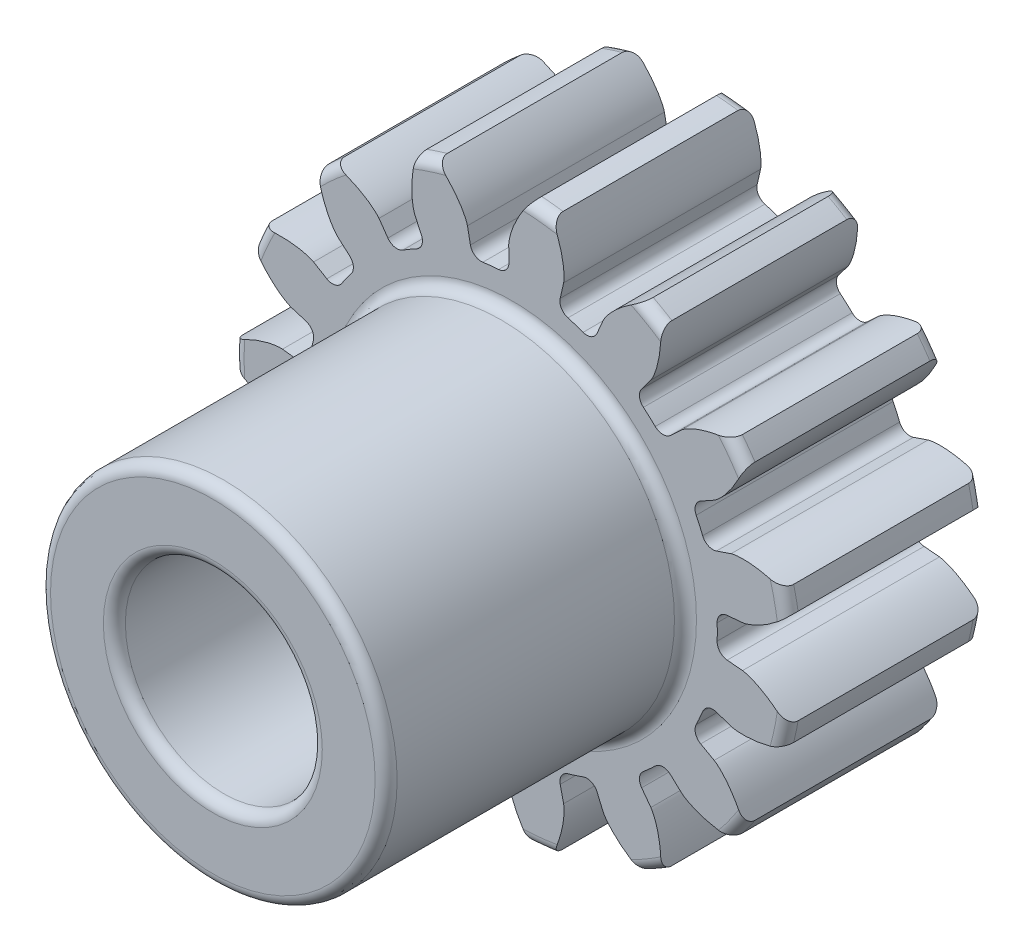
from build123d import *

# Parameters (mm, degrees)
BOSS_EXTRUDE1_DEPTH      = 4.0005
BOSS_EXTRUDE1_DEPTH_BACK = 4.0005
SKETCH3_R                = 4.497916667
SKETCH5_W                = 4.826
SKETCH5_H                = 1.703916667
SKETCH5_W_2              = 8.001
SKETCH5_H_2              = 1.5875
FILLET2_R                = 0.177538081
CUT_EXTRUDE1_DEPTH       = 8.514420186
FILLET1_R                = 0.177538081
CIRPATTERN1_COUNT        = 15
FILLET1_OF_CIRPATTERN1_R = 0.177538081


with BuildPart() as part:
    # Sketch3 → Boss-Extrude1 (new, two sides: drawn at the far end of the back side and taken through both)
    with BuildSketch(Plane.XY.offset(-BOSS_EXTRUDE1_DEPTH_BACK)):
        Circle(SKETCH3_R)
    extrude(amount=BOSS_EXTRUDE1_DEPTH + BOSS_EXTRUDE1_DEPTH_BACK)

    # Sketch5 → Cut-Revolve1 (revolve, cut)
    with BuildSketch(Plane(origin=(0, 0, 0), x_dir=(0, 0, -1), z_dir=(1, 0, 0)), mode=Mode.PRIVATE) as cut_revolve1_sk:
        with Locations((-1.5875, 3.645958334)):
            Rectangle(SKETCH5_W, SKETCH5_H)
        with Locations((0, 0.79375)):
            Rectangle(SKETCH5_W_2, SKETCH5_H_2)
    revolve(cut_revolve1_sk.sketch.rotate(Axis((0, 0, 4.0005), (0, 0, -1)), 90), axis=Axis((0, 0, 4.0005), (0, 0, -1)), mode=Mode.SUBTRACT)

    # Fillet2
    fillet2_edges = [part.edges().sort_by_distance(p)[0] for p in [
        (-1.5875, 0, 4.0005),
        (-1.5875, 0, -4.0005),
        (-2.794, 0, 4.0005),
        (-2.794, 0, -0.8255),
        (-4.497916667, 0, -0.8255),
        (-4.497916667, 0, -4.0005),
    ]]
    fillet(fillet2_edges, radius=FILLET2_R)

    # Sketch4 → Cut-Extrude1 (cut, symmetric)
    with BuildSketch(Plane.XY):
        with BuildLine():
            Line((3.293961, 0.296646422), (3.714373014, 0.334507744))
            add(Edge.make_bspline(
                [(3.714373014, 0.334507744), (3.715619765, 0.334637976), (3.719110772, 0.335058314), (3.725686515, 0.336070329), (3.73637484, 0.33802947), (3.749926645, 0.340977197), (3.767355201, 0.34530378), (3.78776392, 0.351062864), (3.810051586, 0.358082993), (3.834134363, 0.36646295), (3.858004137, 0.375476931), (3.881660408, 0.385074363), (3.905079779, 0.395179288), (3.933265444, 0.408059271), (3.966802216, 0.424390838), (4.005595328, 0.444761977), (4.049092817, 0.469371259), (4.092853418, 0.496044826), (4.13543291, 0.523595205), (4.177866307, 0.552911438), (4.218504087, 0.582324426), (4.260071411, 0.614367962), (4.29811599, 0.644707128), (4.339990308, 0.680325476), (4.373567578, 0.709547342), (4.407603145, 0.741073505), (4.424071435, 0.756614337), (4.432446408, 0.764639247)],
                knots=[0, 0, 0, 0, 0, 0.005376749, 0.015083688, 0.02853182, 0.04661014, 0.064854849, 0.092110525, 0.119476176, 0.146842496, 0.174208854, 0.201574956, 0.228941013, 0.256307345, 0.307035032, 0.361767352, 0.416499661, 0.471231937, 0.525964282, 0.580696616, 0.635428982, 0.690161387, 0.744893688, 0.799626082, 0.854358408, 0.909090915, 0.909090915, 0.909090915, 0.909090915, 0.909090915], degree=4))
            ThreePointArc((4.432446408, 0.764639247), (4.497916667, 0), (4.432446408, -0.764639247))
            add(Edge.make_bspline(
                [(3.714373014, -0.334507744), (3.715619765, -0.334637976), (3.719110772, -0.335058314), (3.725686515, -0.336070329), (3.73637484, -0.33802947), (3.749926645, -0.340977197), (3.767355201, -0.34530378), (3.78776392, -0.351062864), (3.810051586, -0.358082993), (3.834134363, -0.36646295), (3.858004137, -0.375476931), (3.881660408, -0.385074363), (3.905079779, -0.395179288), (3.933265444, -0.408059271), (3.966802216, -0.424390838), (4.005595328, -0.444761977), (4.049092817, -0.469371259), (4.092853418, -0.496044826), (4.13543291, -0.523595205), (4.177866307, -0.552911438), (4.218504087, -0.582324426), (4.260071411, -0.614367962), (4.29811599, -0.644707128), (4.339990308, -0.680325476), (4.373567578, -0.709547342), (4.407603145, -0.741073505), (4.424071435, -0.756614337), (4.432446408, -0.764639247)],
                knots=[0, 0, 0, 0, 0, 0.005376749, 0.015083688, 0.02853182, 0.04661014, 0.064854849, 0.092110525, 0.119476176, 0.146842496, 0.174208854, 0.201574956, 0.228941013, 0.256307345, 0.307035032, 0.361767352, 0.416499661, 0.471231937, 0.525964282, 0.580696616, 0.635428982, 0.690161387, 0.744893688, 0.799626082, 0.854358408, 0.909090915, 0.909090915, 0.909090915, 0.909090915, 0.909090915], degree=4))
            Line((3.714373014, -0.334507744), (3.293961, -0.296646422))
            ThreePointArc((3.293961, -0.296646422), (3.307291667, 0), (3.293961, 0.296646422))
        make_face()
    cut_extrude1 = extrude(amount=CUT_EXTRUDE1_DEPTH, both=True, mode=Mode.SUBTRACT)

    # Fillet1
    fillet1_edges = [part.edges().sort_by_distance(p)[0] for p in [
        (3.293961, -0.296646422, -2.413),
        (3.293961, 0.296646422, -2.413),
    ]]
    fillet(fillet1_edges, radius=FILLET1_R)

    # CirPattern1: Cut-Extrude1 ×15 about axis
    cirpattern1_axis = Axis((0, 0, 4.0005), (0, 0, -1))
    for i in range(1, CIRPATTERN1_COUNT):
        add(cut_extrude1.rotate(cirpattern1_axis, i * 360 / CIRPATTERN1_COUNT), mode=Mode.SUBTRACT)

    # Fillet1 of CirPattern1
    fillet1_of_cirpattern1_edges = [part.edges().sort_by_distance(p)[0] for p in [
        (2.888526139, -1.610774631, -2.413),
        (3.129840079, -1.068774648, -2.413),
        (1.983638868, -2.646385273, -2.413),
        (2.424541375, -2.249394872, -2.413),
        (0.735762415, -3.224411859, -2.413),
        (1.30001744, -3.041074288, -2.413),
        (-0.639334043, -3.244908342, -2.413),
        (-0.04929132, -3.306924331, -2.413),
        (-1.903883837, -2.704330694, -2.413),
        (-1.390077163, -3.000977116, -2.413),
        (-2.83923482, -1.696149701, -2.413),
        (-2.490506036, -2.176133694, -2.413),
        (-3.283656308, -0.394689015, -2.413),
        (-3.16030379, -0.975016987, -2.413),
        (-3.16030379, 0.975016987, -2.413),
        (-3.283656308, 0.394689015, -2.413),
        (-2.490506036, 2.176133694, -2.413),
        (-2.83923482, 1.696149701, -2.413),
        (-1.390077163, 3.000977116, -2.413),
        (-1.903883837, 2.704330694, -2.413),
        (-0.04929132, 3.306924331, -2.413),
        (-0.639334043, 3.244908342, -2.413),
        (1.30001744, 3.041074288, -2.413),
        (0.735762415, 3.224411859, -2.413),
        (2.424541375, 2.249394872, -2.413),
        (1.983638868, 2.646385273, -2.413),
        (3.129840079, 1.068774648, -2.413),
        (2.888526139, 1.610774631, -2.413),
    ]]
    fillet(fillet1_of_cirpattern1_edges, radius=FILLET1_OF_CIRPATTERN1_R)


solid = part.part
